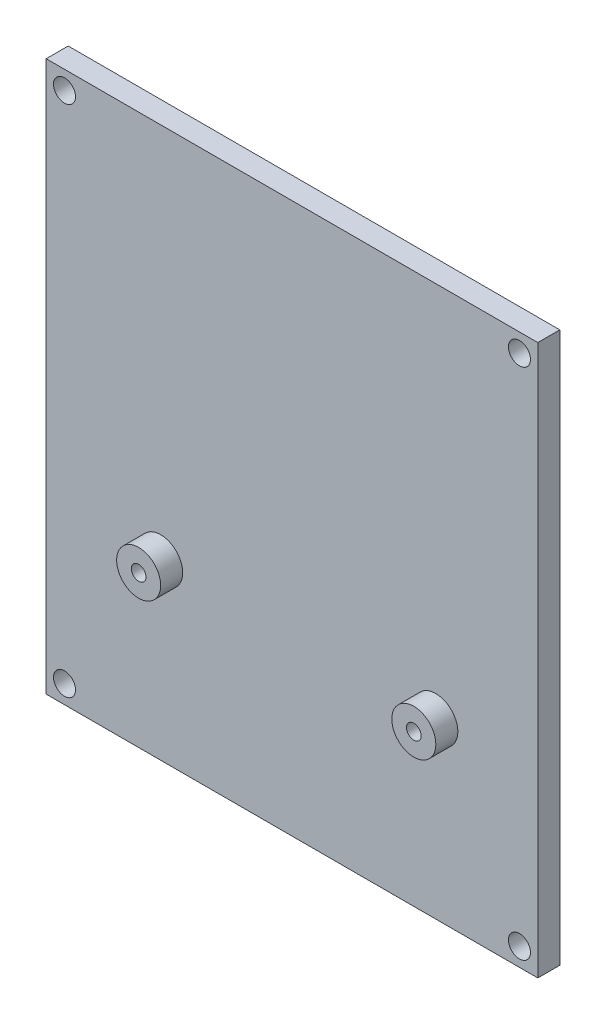
from build123d import *

# Parameters (mm, degrees)
SKETCH1_W           = 67
SKETCH1_H           = 75
BOSS_EXTRUDE1_DEPTH = 3
SKETCH2_R           = 1.5
CUT_EXTRUDE1_DEPTH  = 3
SKETCH3_R           = 3
SKETCH3_R_2         = 1
BOSS_EXTRUDE2_DEPTH = 3


with BuildPart() as part:
    # Sketch1 → Boss-Extrude1 (new body)
    with BuildSketch(Plane.XY):
        Rectangle(SKETCH1_W, SKETCH1_H)
    extrude(amount=BOSS_EXTRUDE1_DEPTH)

    # Sketch2 → Cut-Extrude1 (cut)
    with BuildSketch(Plane.XY.offset(3)):
        with Locations((-31, 35)):
            Circle(SKETCH2_R)
        with Locations((31, 35)):
            Circle(SKETCH2_R)
        with Locations((31, -35)):
            Circle(SKETCH2_R)
        with Locations((-31, -35)):
            Circle(SKETCH2_R)
    extrude(amount=-CUT_EXTRUDE1_DEPTH, mode=Mode.SUBTRACT)

    # Sketch3 → Boss-Extrude2 (add)
    # profile 1 of 2: a face of its own
    with BuildSketch(Plane.XY.offset(3)):
        with Locations(Location((-17.899535592, -13.876081532, 0), (0, 0, 180))):
            Circle(SKETCH3_R)
        with Locations((-17.899535592, -13.876081532)):
            Circle(SKETCH3_R_2, mode=Mode.SUBTRACT)
    # profile 2 of 2: a face of its own
    with BuildSketch(Plane.XY.offset(3)):
        with Locations(Location((19.600464408, -13.876081532, 0), (0, 0, 180))):
            Circle(SKETCH3_R)
        with Locations((19.600464408, -13.876081532)):
            Circle(SKETCH3_R_2, mode=Mode.SUBTRACT)
    extrude(amount=BOSS_EXTRUDE2_DEPTH)


solid = part.part
